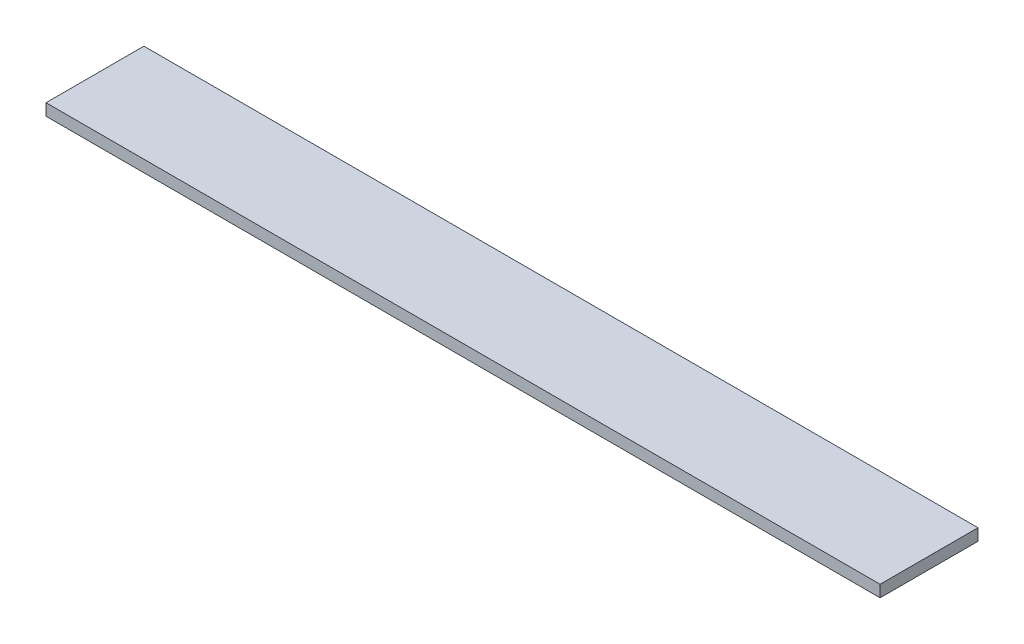
from build123d import *

# Parameters (mm, degrees)
SKETCH1_W           = 270.51
SKETCH1_H           = 31.75
BOSS_EXTRUDE1_DEPTH = 3.81


with BuildPart() as part:
    # Sketch1 → Boss-Extrude1 (new body)
    with BuildSketch(Plane(origin=(0, 0, 0), x_dir=(1, 0, 0), z_dir=(0, 1, 0))):
        Rectangle(SKETCH1_W, SKETCH1_H)
    extrude(amount=BOSS_EXTRUDE1_DEPTH)


solid = part.part
